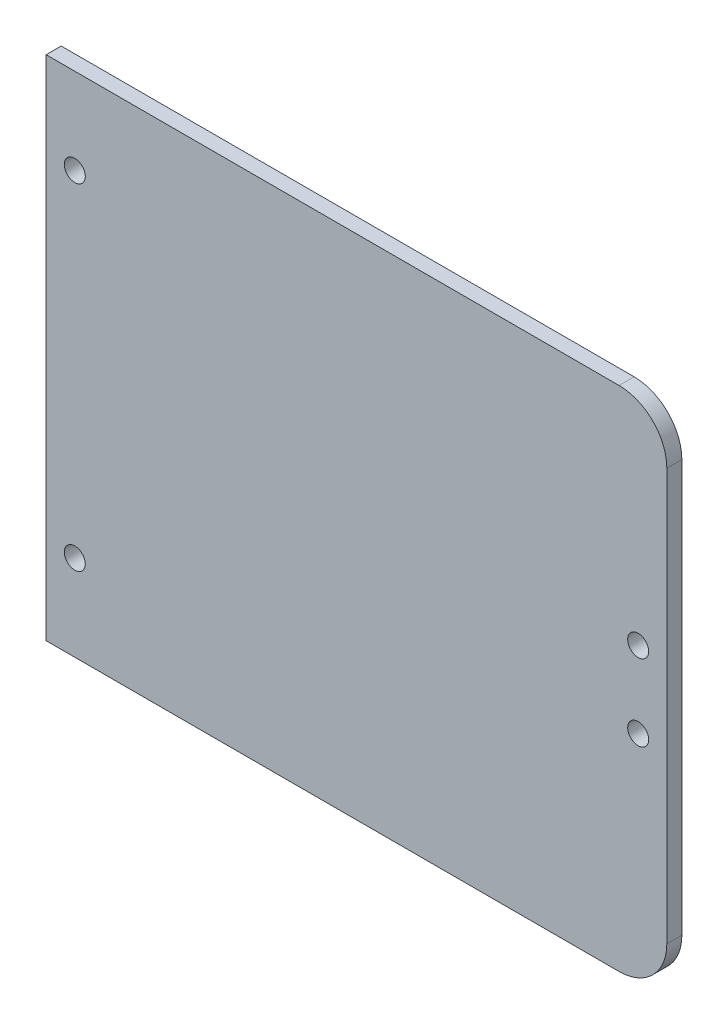
from build123d import *

# Parameters (mm, degrees)
F_20_MCAT_BPL2_PCB_OUTLINE_R = 1.1
BOSS_EXTRUDE1_DEPTH          = 1.5748


with BuildPart() as part:
    # 20 MCAT BPL2 PCB Outline → Boss-Extrude1 (new body)
    with BuildSketch(Plane.XY):
        with BuildLine():
            Line((0, -53.15), (0, 0))
            Line((0, 0), (60, 0))
            ThreePointArc((60, 0), (63.535533906, -1.464466094), (65, -5))
            Line((65, -5), (65, -48.15))
            ThreePointArc((65, -48.15), (63.535533906, -51.685533906), (60, -53.15))
            Line((60, -53.15), (0, -53.15))
        make_face()
        with Locations((3, -44.15)):
            Circle(F_20_MCAT_BPL2_PCB_OUTLINE_R, mode=Mode.SUBTRACT)
        with Locations((62, -30.575)):
            Circle(F_20_MCAT_BPL2_PCB_OUTLINE_R, mode=Mode.SUBTRACT)
        with Locations((3, -9)):
            Circle(F_20_MCAT_BPL2_PCB_OUTLINE_R, mode=Mode.SUBTRACT)
        with Locations((62, -22.575)):
            Circle(F_20_MCAT_BPL2_PCB_OUTLINE_R, mode=Mode.SUBTRACT)
    extrude(amount=-BOSS_EXTRUDE1_DEPTH)


solid = part.part
